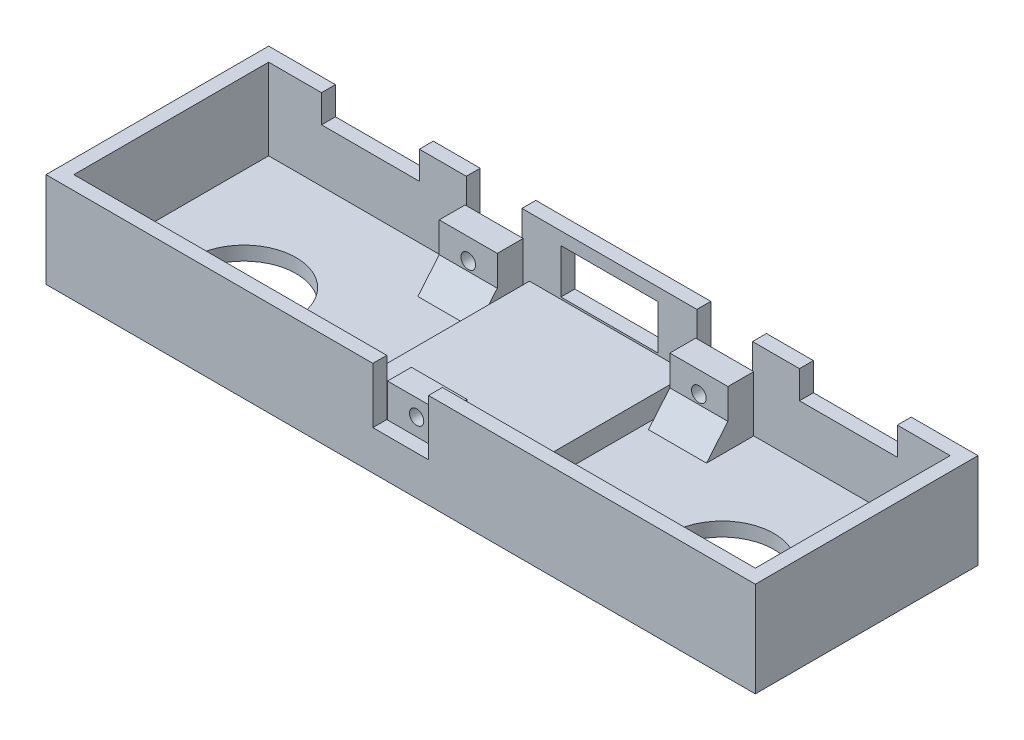
from build123d import *

# Parameters (mm, degrees)
SKETCH1_W            = 89.2
SKETCH1_H            = 28
BOSS_EXTRUDE1_DEPTH  = 11.95
SHELL1_T             = -1.75
SKETCH2_R            = 6.55
CUT_EXTRUDE1_DEPTH   = 95.04615888
SKETCH3_W            = 12.3
SKETCH3_H            = 3.5
CUT_EXTRUDE2_DEPTH   = 11.95
SKETCH4_W            = 12.2
SKETCH4_H            = 5.6
CUT_EXTRUDE3_DEPTH   = 11.95
SKETCH5_W            = 20.1
SKETCH5_H            = 24.5
BOSS_EXTRUDE2_DEPTH  = 2.75
SKETCH6_W            = 16.1
SKETCH6_H            = 24.25
CUT_EXTRUDE4_DEPTH   = 3.95
CUT_EXTRUDE6_DEPTH   = 2
CUT_EXTRUDE10_REACH  = 96.252
SKETCH14_W           = 7
SKETCH14_H           = 7
SKETCH15_W           = 7
SKETCH15_H           = 3
BOSS_EXTRUDE3_DEPTH  = 4.35
BOSS_EXTRUDE5_DEPTH  = 7
SKETCH17_W           = 7
SKETCH17_H           = 8.5
CUT_EXTRUDE11_DEPTH  = 1.75
SKETCH18_W           = 7.3
SKETCH18_H           = 3.25
BOSS_EXTRUDE6_DEPTH  = 7
SKETCH20_R           = 0.925
CUT_EXTRUDE12_DEPTH  = 3.25
CUT_EXTRUDE14_REACH  = 95.719
SKETCH26_R           = 0.9
BOSS_EXTRUDE9_DEPTH  = 7.3
BOSS_EXTRUDE10_DEPTH = 7.3


with BuildPart() as part:
    # Sketch1 → Boss-Extrude1 (new body)
    with BuildSketch(Plane(origin=(0, 0, 0), x_dir=(1, 0, 0), z_dir=(0, 1, 0))):
        with Locations((44.6, 14)):
            Rectangle(SKETCH1_W, SKETCH1_H)
    extrude(amount=BOSS_EXTRUDE1_DEPTH)

    # Shell1
    shell1_openings = [part.faces().sort_by_distance(p)[0] for p in [
        (44.6, 11.95, -14),
    ]]
    offset(amount=SHELL1_T, openings=shell1_openings, kind=Kind.INTERSECTION)

    # Sketch2 → Cut-Extrude1 (cut, through all)
    with BuildSketch(Plane(origin=(0, 1.75, 0), x_dir=(1, 0, 0), z_dir=(0, 1, 0))):
        with Locations(Location((14.55, 10.35, 0), (0, 0, 270))):
            Circle(SKETCH2_R)
        with Locations(Location((74.65, 10.35, 0), (0, 0, 270))):
            Circle(SKETCH2_R)
    extrude(amount=-CUT_EXTRUDE1_DEPTH, mode=Mode.SUBTRACT)

    # Sketch3 → Cut-Extrude2 (cut)
    with BuildSketch(Plane.XY.offset(-26.25)):
        with Locations((14.55, 10.2)):
            Rectangle(SKETCH3_W, SKETCH3_H)
        with Locations((74.65, 10.2)):
            Rectangle(SKETCH3_W, SKETCH3_H)
    extrude(amount=-CUT_EXTRUDE2_DEPTH, mode=Mode.SUBTRACT)

    # Sketch4 → Cut-Extrude3 (cut)
    with BuildSketch(Plane.XY.offset(-26.25)):
        with Locations((44.6, 7.55)):
            Rectangle(SKETCH4_W, SKETCH4_H)
    extrude(amount=-CUT_EXTRUDE3_DEPTH, mode=Mode.SUBTRACT)

    # Sketch5 → Boss-Extrude2 (add)
    with BuildSketch(Plane(origin=(0, 1.75, 0), x_dir=(1, 0, 0), z_dir=(0, 1, 0))):
        with Locations((44.6, 14)):
            Rectangle(SKETCH5_W, SKETCH5_H)
    extrude(amount=BOSS_EXTRUDE2_DEPTH)

    # Sketch6 → Cut-Extrude4 (cut)
    with BuildSketch(Plane.XZ):
        with Locations((44.6, -13.875)):
            Rectangle(SKETCH6_W, SKETCH6_H)
    extrude(amount=-CUT_EXTRUDE4_DEPTH, mode=Mode.SUBTRACT)

    # Sketch8 → Cut-Extrude6 (cut)
    with BuildSketch(Plane(origin=(0, 0, -28), x_dir=(-1, 0, 0), z_dir=(0, 0, -1))):
        Polygon((-50.7, 3.45), (-38.5, 3.45), (-36.55, 0), (-52.65, 0), align=None)
    extrude(amount=-CUT_EXTRUDE6_DEPTH, mode=Mode.SUBTRACT)

    # Sketch14 → Cut-Extrude10 (cut, up to next)
    with BuildSketch(Plane.XY, mode=Mode.PRIVATE) as cut_extrude10_sk1:
        with Locations((44.6, 8.45)):
            Rectangle(SKETCH14_W, SKETCH14_H)
    cut_extrude10_tool1 = extrude(cut_extrude10_sk1.sketch, amount=-CUT_EXTRUDE10_REACH, mode=Mode.PRIVATE) & part.part
    add(cut_extrude10_tool1.solids().sort_by_distance((44.6, 8.45, 0))[0], mode=Mode.SUBTRACT)

    # Sketch17 → Cut-Extrude11 (cut)
    with BuildSketch(Plane(origin=(0, 0, -28), x_dir=(-1, 0, 0), z_dir=(0, 0, -1))):
        with Locations((-59.1, 7.7)):
            Rectangle(SKETCH17_W, SKETCH17_H)
        with Locations((-30.1, 7.7)):
            Rectangle(SKETCH17_W, SKETCH17_H)
    extrude(amount=-CUT_EXTRUDE11_DEPTH, mode=Mode.SUBTRACT)

    # Sketch18 → Boss-Extrude6 (add)
    with BuildSketch(Plane(origin=(0, 1.75, 0), x_dir=(1, 0, 0), z_dir=(0, 1, 0))):
        with Locations((59.1, 24.625)):
            Rectangle(SKETCH18_W, SKETCH18_H)
        with Locations((30.1, 24.625)):
            Rectangle(SKETCH18_W, SKETCH18_H)
    extrude(amount=BOSS_EXTRUDE6_DEPTH)

    # Sketch20 → Cut-Extrude12 (cut)
    with BuildSketch(Plane(origin=(0, 0, -26.25), x_dir=(-1, 0, 0), z_dir=(0, 0, -1))):
        with Locations((-59.1, 6.1)):
            Circle(SKETCH20_R)
        with Locations((-30.1, 6.1)):
            Circle(SKETCH20_R)
    extrude(amount=-CUT_EXTRUDE12_DEPTH, mode=Mode.SUBTRACT)

    # Sketch27 → Boss-Extrude9 (add)
    with BuildSketch(Plane.ZY.offset(-26.45)):
        Polygon((-23, 1.75), (-20.31, 1.75), (-23, 4.955817164), align=None)
    extrude(amount=-BOSS_EXTRUDE9_DEPTH)

    # Sketch28 → Boss-Extrude10 (add)
    with BuildSketch(Plane(origin=(62.75, 0, 0), x_dir=(0, 0, -1), z_dir=(1, 0, 0))):
        Polygon((23, 1.75), (20.31, 1.75), (23, 4.955817164), align=None)
    extrude(amount=-BOSS_EXTRUDE10_DEPTH)


with BuildPart() as body_2:
    # Sketch15 → Boss-Extrude3 (new body)
    with BuildSketch(Plane(origin=(0, 4.75, 0), x_dir=(1, 0, 0), z_dir=(0, 1, 0))):
        with Locations((44.6, 3.35)):
            Rectangle(SKETCH15_W, SKETCH15_H)
    extrude(amount=BOSS_EXTRUDE3_DEPTH)


with BuildPart() as body_3:
    # Sketch16 → Boss-Extrude5 (new body)
    with BuildSketch(Plane(origin=(48.1, 0, 0), x_dir=(0, 0, -1), z_dir=(1, 0, 0))):
        Polygon((4.85, 7.567485507), (8.020929785, 4.75), (4.85, 4.75), align=None)
    extrude(amount=-BOSS_EXTRUDE5_DEPTH)


with BuildPart() as cut_extrude14_tool:
    # Cut-Extrude14: up to this plane
    cut_extrude14_end = Plane(origin=(36.85818196, 7.567485507, -4.85), z_dir=(0, 0.7475402658182556, -0.6642164940592575))
    # Sketch26 → Cut-Extrude14 (new, up to the surface)
    with BuildSketch(Plane.XY.offset(-1.85), mode=Mode.PRIVATE) as cut_extrude14_sk1:
        with Locations((44.755335946, 7)):
            Circle(SKETCH26_R)
    cut_extrude14_tool1 = split(extrude(cut_extrude14_sk1.sketch, amount=-CUT_EXTRUDE14_REACH, mode=Mode.PRIVATE), bisect_by=cut_extrude14_end, keep=Keep.BOTH, mode=Mode.PRIVATE)
    add(cut_extrude14_tool1.solids().sort_by_distance((44.755336, 7, -1.85))[0])


with BuildPart() as body_2_1:
    add(body_2.part)

    # Cut-Extrude14: cut by cut_extrude14_tool
    add(cut_extrude14_tool.part, mode=Mode.SUBTRACT)


with BuildPart() as body_3_1:
    add(body_3.part)

    # Cut-Extrude14: cut by cut_extrude14_tool
    add(cut_extrude14_tool.part, mode=Mode.SUBTRACT)


solid = Compound([part.part, body_2_1.part, body_3_1.part])
